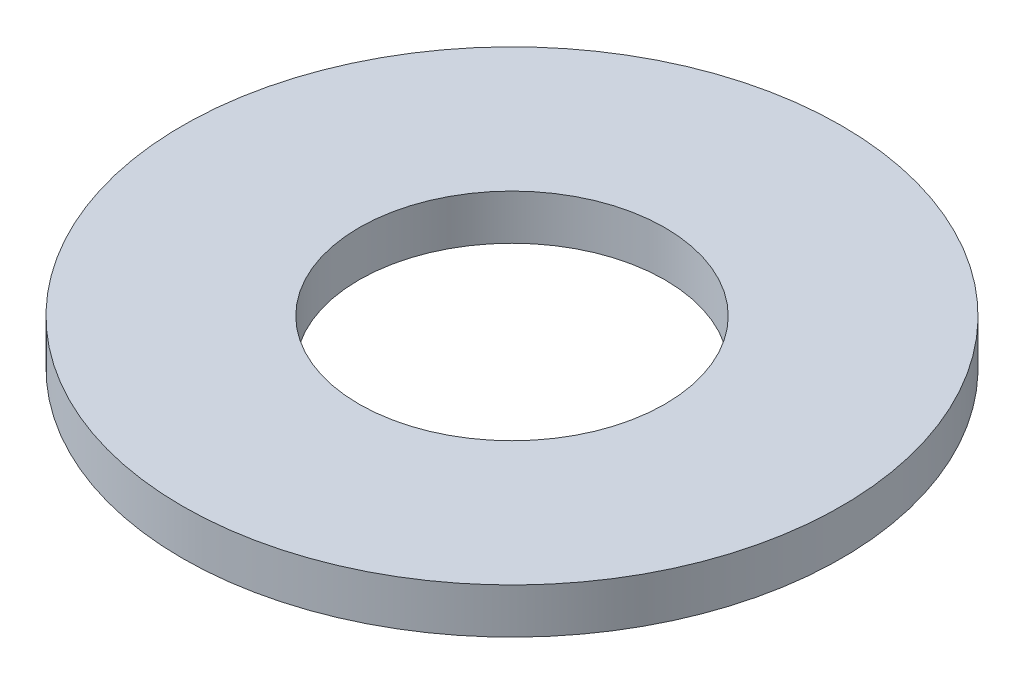
from build123d import *

# Parameters (mm, degrees)
SKETCH1_R           = 11.1125
BOSS_EXTRUDE1_DEPTH = 1.524
SKETCH5_R           = 5.1562
CUT_EXTRUDE1_DEPTH  = 16.789169975


with BuildPart() as part:
    # Sketch1 → Boss-Extrude1 (new body)
    with BuildSketch(Plane(origin=(0, 0, 0), x_dir=(1, 0, 0), z_dir=(0, 1, 0))):
        with Locations(Location((0, 0, 0), (0, 0, 90))):
            Circle(SKETCH1_R)
    extrude(amount=BOSS_EXTRUDE1_DEPTH)

    # Sketch5 → Cut-Extrude1 (cut, through all)
    with BuildSketch(Plane(origin=(0, 1.524, 0), x_dir=(-1, 0, 0), z_dir=(0, 1, 0))):
        with Locations(Location((0, 0, 0), (0, 0, 90))):
            Circle(SKETCH5_R)
    extrude(amount=-CUT_EXTRUDE1_DEPTH, mode=Mode.SUBTRACT)


solid = part.part
